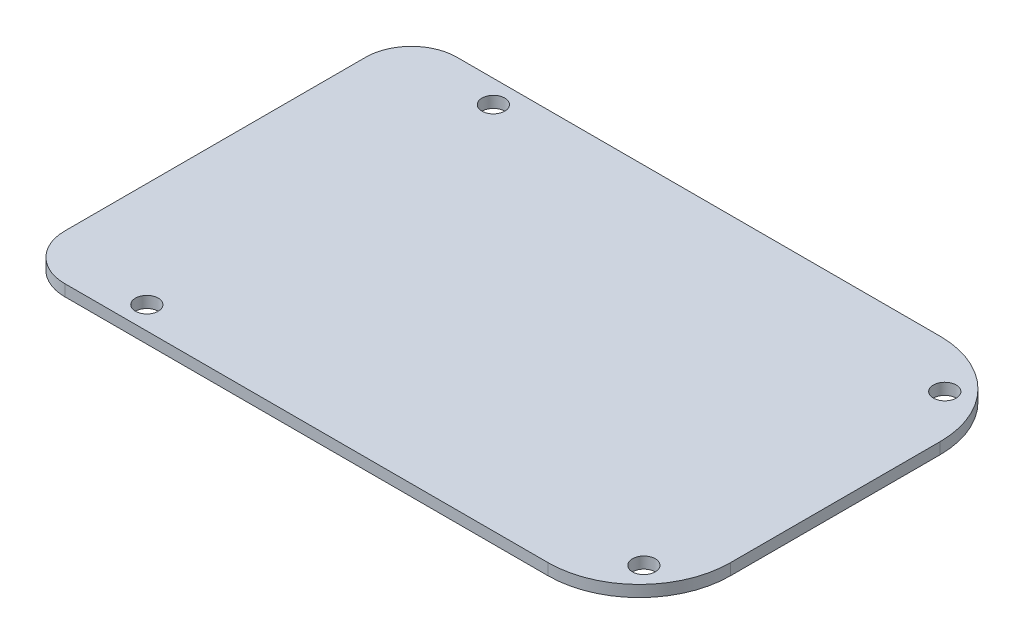
from build123d import *

# Parameters (mm, degrees)
SKETCH1_R           = 1.5875
BOSS_EXTRUDE1_DEPTH = 1.5875


with BuildPart() as part:
    # Sketch1 → Boss-Extrude1 (new body)
    with BuildSketch(Plane(origin=(0, 0, 0), x_dir=(1, 0, 0), z_dir=(0, 1, 0))):
        with BuildLine():
            Line((-36.83, 27.305), (30.48, 27.305))
            ThreePointArc((30.48, 27.305), (39.460256121, 23.585256121), (43.18, 14.605))
            Line((43.18, 14.605), (43.18, -14.605))
            ThreePointArc((43.18, -14.605), (39.460256121, -23.585256121), (30.48, -27.305))
            Line((30.48, -27.305), (-36.83, -27.305))
            ThreePointArc((-36.83, -27.305), (-41.320128061, -25.445128061), (-43.18, -20.955))
            Line((-43.18, -20.955), (-43.18, 20.955))
            ThreePointArc((-43.18, 20.955), (-41.320128061, 25.445128061), (-36.83, 27.305))
        make_face()
        with Locations(Location((-28.575, 24.13, 0), (0, 0, 270))):
            Circle(SKETCH1_R, mode=Mode.SUBTRACT)
        with Locations(Location((-28.575, -24.13, 0), (0, 0, 270))):
            Circle(SKETCH1_R, mode=Mode.SUBTRACT)
        with Locations(Location((37.465, -20.955, 0), (0, 0, 270))):
            Circle(SKETCH1_R, mode=Mode.SUBTRACT)
        with Locations(Location((37.465, 20.955, 0), (0, 0, 270))):
            Circle(SKETCH1_R, mode=Mode.SUBTRACT)
    extrude(amount=BOSS_EXTRUDE1_DEPTH)


solid = part.part
